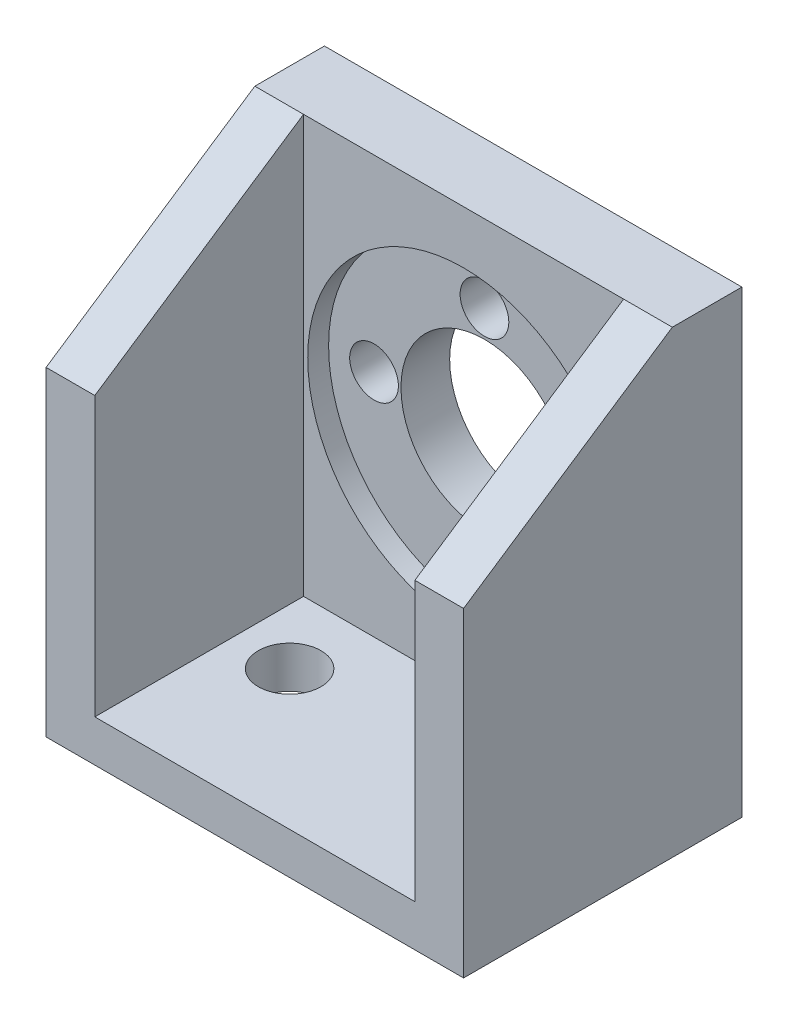
from build123d import *

# Parameters (mm, degrees)
SKETCH1_W           = 30
SKETCH1_H           = 33
BOSS_EXTRUDE1_DEPTH = 5
BOSS_EXTRUDE2_DEPTH = 15
CUT_EXTRUDE1_DEPTH  = 40.651607786
SKETCH4_R           = 6
SKETCH4_R_2         = 1.75
CUT_EXTRUDE2_DEPTH  = 27.874709301
SKETCH5_R           = 11.1989
CUT_EXTRUDE3_DEPTH  = 1.5
SKETCH6_R           = 2.25
CUT_EXTRUDE4_DEPTH  = 40.05124838


with BuildPart() as part:
    # Sketch1 → Boss-Extrude1 (new body)
    with BuildSketch(Plane.XY):
        Rectangle(SKETCH1_W, SKETCH1_H)
    extrude(amount=BOSS_EXTRUDE1_DEPTH)

    # Sketch2 → Boss-Extrude2 (add)
    with BuildSketch(Plane.XY.offset(5)):
        Polygon((-15, 16.5), (-15, -16.5), (15, -16.5), (15, 16.5), (11.5, 16.5), (11.5, -13.5), (-11.5, -13.5), (-11.5, 16.5), align=None)
    extrude(amount=BOSS_EXTRUDE2_DEPTH)

    # Sketch3 → Cut-Extrude1 (cut, through all)
    with BuildSketch(Plane(origin=(15, 0, 0), x_dir=(0, 0, -1), z_dir=(1, 0, 0))):
        Polygon((-5, 16.5), (-20, 16.5), (-20, 6.5), align=None)
    extrude(amount=-CUT_EXTRUDE1_DEPTH, mode=Mode.SUBTRACT)

    # Sketch4 → Cut-Extrude2 (cut, through all)
    with BuildSketch(Plane.XY.offset(5)):
        with Locations((0, 1.5)):
            Circle(SKETCH4_R)
        with Locations((0, 9.43405)):
            Circle(SKETCH4_R_2)
        with Locations((-7.93405, 1.5)):
            Circle(SKETCH4_R_2)
        with Locations((7.93405, 1.5)):
            Circle(SKETCH4_R_2)
        with Locations((0, -6.43405)):
            Circle(SKETCH4_R_2)
    extrude(amount=-CUT_EXTRUDE2_DEPTH, mode=Mode.SUBTRACT)

    # Sketch5 → Cut-Extrude3 (cut)
    with BuildSketch(Plane.XY.offset(5)):
        with Locations((0, 1.5)):
            Circle(SKETCH5_R)
    extrude(amount=-CUT_EXTRUDE3_DEPTH, mode=Mode.SUBTRACT)

    # Sketch6 → Cut-Extrude4 (cut, through all)
    with BuildSketch(Plane(origin=(0, -13.5, 0), x_dir=(1, 0, 0), z_dir=(0, 1, 0))):
        with Locations(Location((-7.5, -10, 0), (0, 0, 180))):
            Circle(SKETCH6_R)
        with Locations(Location((7.5, -10, 0), (0, 0, 180))):
            Circle(SKETCH6_R)
    extrude(amount=-CUT_EXTRUDE4_DEPTH, mode=Mode.SUBTRACT)


solid = part.part
